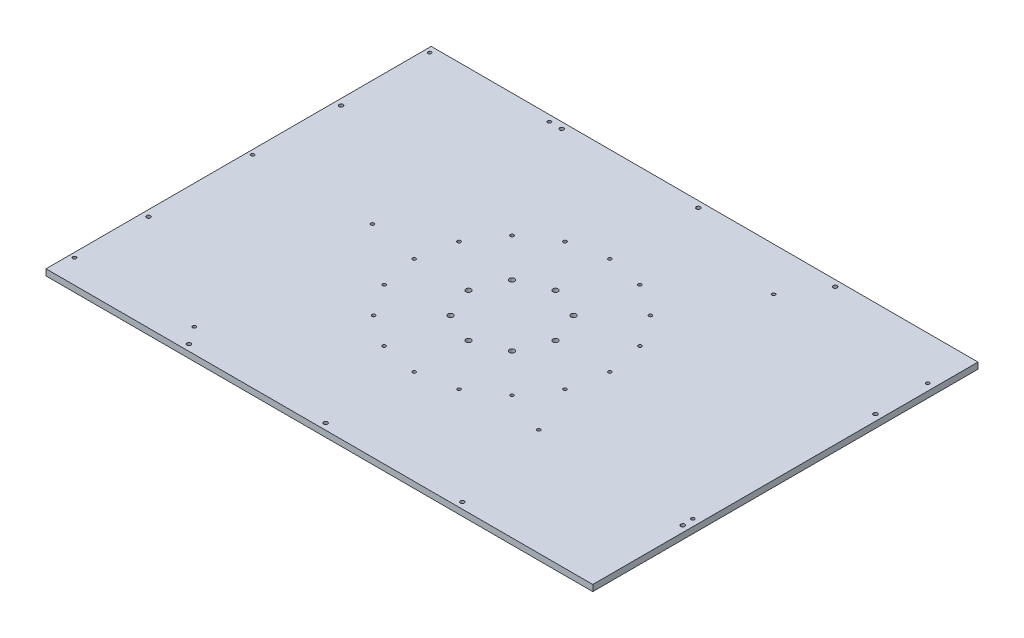
from build123d import *

# Parameters (mm, degrees)
SKETCH1_W           = 440
SKETCH1_H           = 310
SKETCH1_R           = 1.35
SKETCH1_R_2         = 1.6
SKETCH1_R_3         = 2.1
BOSS_EXTRUDE1_DEPTH = 2.5


with BuildPart() as part:
    # Sketch1 → Boss-Extrude1 (new, symmetric)
    with BuildSketch(Plane(origin=(0, 0, 0), x_dir=(1, 0, 0), z_dir=(0, 1, 0))):
        Rectangle(SKETCH1_W, SKETCH1_H)
        with Locations(Location((-216.3, -135.76, 0), (0, 0, 270))):
            Circle(SKETCH1_R, mode=Mode.SUBTRACT)
        with Locations(Location((-119.9, -135.76, 0), (0, 0, 270))):
            Circle(SKETCH1_R, mode=Mode.SUBTRACT)
        with Locations(Location((-110, -150, 0), (0, 0, 270))):
            Circle(SKETCH1_R_2, mode=Mode.SUBTRACT)
        with Locations(Location((-215, -77.5, 0), (0, 0, 270))):
            Circle(SKETCH1_R_2, mode=Mode.SUBTRACT)
        with Locations(Location((-55.684659018, -55.684659018, 0), (0, 0, 270))):
            Circle(SKETCH1_R, mode=Mode.SUBTRACT)
        with Locations(Location((-30.136320299, -72.755513185, 0), (0, 0, 270))):
            Circle(SKETCH1_R, mode=Mode.SUBTRACT)
        with Locations(Location((-72.755513185, -30.136320299, 0), (0, 0, 270))):
            Circle(SKETCH1_R, mode=Mode.SUBTRACT)
        with Locations(Location((-78.75, 0, 0), (0, 0, 270))):
            Circle(SKETCH1_R, mode=Mode.SUBTRACT)
        with Locations(Location((-24.748737342, -24.748737342, 0), (0, 0, 270))):
            Circle(SKETCH1_R_3, mode=Mode.SUBTRACT)
        with Locations(Location((0, -150, 0), (0, 0, 270))):
            Circle(SKETCH1_R_2, mode=Mode.SUBTRACT)
        with Locations(Location((110, -150, 0), (0, 0, 270))):
            Circle(SKETCH1_R_2, mode=Mode.SUBTRACT)
        with Locations(Location((0, -78.75, 0), (0, 0, 270))):
            Circle(SKETCH1_R, mode=Mode.SUBTRACT)
        with Locations(Location((30.136320299, -72.755513185, 0), (0, 0, 270))):
            Circle(SKETCH1_R, mode=Mode.SUBTRACT)
        with Locations(Location((90.5, -69, 0), (0, 0, 270))):
            Circle(SKETCH1_R, mode=Mode.SUBTRACT)
        with Locations(Location((55.684659018, -55.684659018, 0), (0, 0, 270))):
            Circle(SKETCH1_R, mode=Mode.SUBTRACT)
        with Locations(Location((0, -35, 0), (0, 0, 270))):
            Circle(SKETCH1_R_3, mode=Mode.SUBTRACT)
        with Locations(Location((24.748737342, -24.748737342, 0), (0, 0, 270))):
            Circle(SKETCH1_R_3, mode=Mode.SUBTRACT)
        with Locations(Location((35, 0, 0), (0, 0, 270))):
            Circle(SKETCH1_R_3, mode=Mode.SUBTRACT)
        with Locations(Location((72.755513185, -30.136320299, 0), (0, 0, 270))):
            Circle(SKETCH1_R, mode=Mode.SUBTRACT)
        with Locations(Location((215, -77.5, 0), (0, 0, 270))):
            Circle(SKETCH1_R_2, mode=Mode.SUBTRACT)
        with Locations(Location((214.5, -69, 0), (0, 0, 270))):
            Circle(SKETCH1_R, mode=Mode.SUBTRACT)
        with Locations(Location((-216.3, 7.5, 0), (0, 0, 270))):
            Circle(SKETCH1_R, mode=Mode.SUBTRACT)
        with Locations(Location((-119.9, 7.5, 0), (0, 0, 270))):
            Circle(SKETCH1_R, mode=Mode.SUBTRACT)
        with Locations(Location((-215, 77.5, 0), (0, 0, 270))):
            Circle(SKETCH1_R_2, mode=Mode.SUBTRACT)
        with Locations(Location((-72.755513185, 30.136320299, 0), (0, 0, 270))):
            Circle(SKETCH1_R, mode=Mode.SUBTRACT)
        with Locations(Location((-35, 0, 0), (0, 0, 270))):
            Circle(SKETCH1_R_3, mode=Mode.SUBTRACT)
        with Locations(Location((-24.748737342, 24.748737342, 0), (0, 0, 270))):
            Circle(SKETCH1_R_3, mode=Mode.SUBTRACT)
        with Locations(Location((-55.684659018, 55.684659018, 0), (0, 0, 270))):
            Circle(SKETCH1_R, mode=Mode.SUBTRACT)
        with Locations(Location((-30.136320299, 72.755513185, 0), (0, 0, 270))):
            Circle(SKETCH1_R, mode=Mode.SUBTRACT)
        with Locations(Location((-216.3, 150, 0), (0, 0, 270))):
            Circle(SKETCH1_R, mode=Mode.SUBTRACT)
        with Locations(Location((-119.9, 150, 0), (0, 0, 270))):
            Circle(SKETCH1_R, mode=Mode.SUBTRACT)
        with Locations(Location((0, 78.75, 0), (0, 0, 270))):
            Circle(SKETCH1_R, mode=Mode.SUBTRACT)
        with Locations(Location((-110, 150, 0), (0, 0, 270))):
            Circle(SKETCH1_R_2, mode=Mode.SUBTRACT)
        with Locations(Location((24.748737342, 24.748737342, 0), (0, 0, 270))):
            Circle(SKETCH1_R_3, mode=Mode.SUBTRACT)
        with Locations(Location((0, 35, 0), (0, 0, 270))):
            Circle(SKETCH1_R_3, mode=Mode.SUBTRACT)
        with Locations(Location((78.75, 0, 0), (0, 0, 270))):
            Circle(SKETCH1_R, mode=Mode.SUBTRACT)
        with Locations(Location((72.755513185, 30.136320299, 0), (0, 0, 270))):
            Circle(SKETCH1_R, mode=Mode.SUBTRACT)
        with Locations(Location((30.136320299, 72.755513185, 0), (0, 0, 270))):
            Circle(SKETCH1_R, mode=Mode.SUBTRACT)
        with Locations(Location((55.684659018, 55.684659018, 0), (0, 0, 270))):
            Circle(SKETCH1_R, mode=Mode.SUBTRACT)
        with Locations(Location((215, 77.5, 0), (0, 0, 270))):
            Circle(SKETCH1_R_2, mode=Mode.SUBTRACT)
        with Locations(Location((0, 150, 0), (0, 0, 270))):
            Circle(SKETCH1_R_2, mode=Mode.SUBTRACT)
        with Locations(Location((90.5, 120, 0), (0, 0, 270))):
            Circle(SKETCH1_R, mode=Mode.SUBTRACT)
        with Locations(Location((110, 150, 0), (0, 0, 270))):
            Circle(SKETCH1_R_2, mode=Mode.SUBTRACT)
        with Locations(Location((214.5, 120, 0), (0, 0, 270))):
            Circle(SKETCH1_R, mode=Mode.SUBTRACT)
    extrude(amount=BOSS_EXTRUDE1_DEPTH, both=True)


solid = part.part
